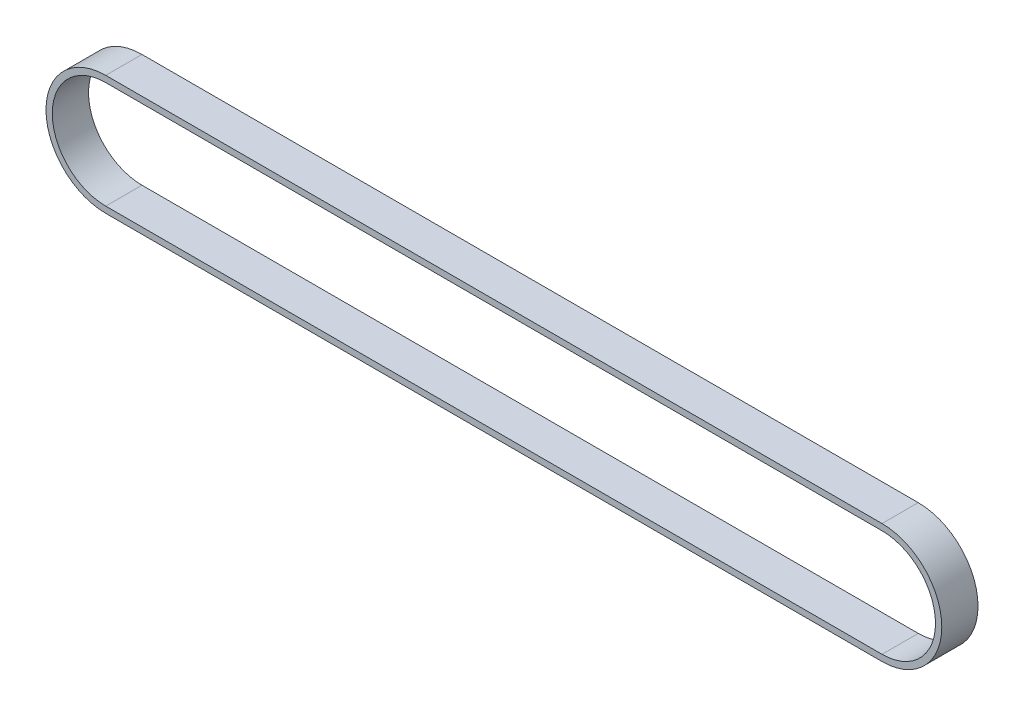
from build123d import *

# Parameters (mm, degrees)
BOSS_EXTRUDE1_DEPTH = 6.4
CUT_EXTRUDE1_DEPTH  = 149.245156751


with BuildPart() as part:
    # Sketch1 → Boss-Extrude1 (new body)
    with BuildSketch(Plane.XY):
        with BuildLine():
            Line((0, 10.56), (137.17, 10.56))
            ThreePointArc((137.17, 10.56), (147.73, 0), (137.17, -10.56))
            Line((137.17, -10.56), (0, -10.56))
            ThreePointArc((0, -10.56), (-10.56, 0), (0, 10.56))
        make_face()
    extrude(amount=BOSS_EXTRUDE1_DEPTH)

    # Sketch2 → Cut-Extrude1 (cut, through all)
    with BuildSketch(Plane.XY.offset(6.4)):
        with BuildLine():
            Line((0, 9.45), (137.17, 9.45))
            ThreePointArc((137.17, 9.45), (146.62, 0), (137.17, -9.45))
            Line((137.17, -9.45), (0, -9.45))
            ThreePointArc((0, -9.45), (-9.45, 0), (0, 9.45))
        make_face()
    extrude(amount=-CUT_EXTRUDE1_DEPTH, mode=Mode.SUBTRACT)


solid = part.part
